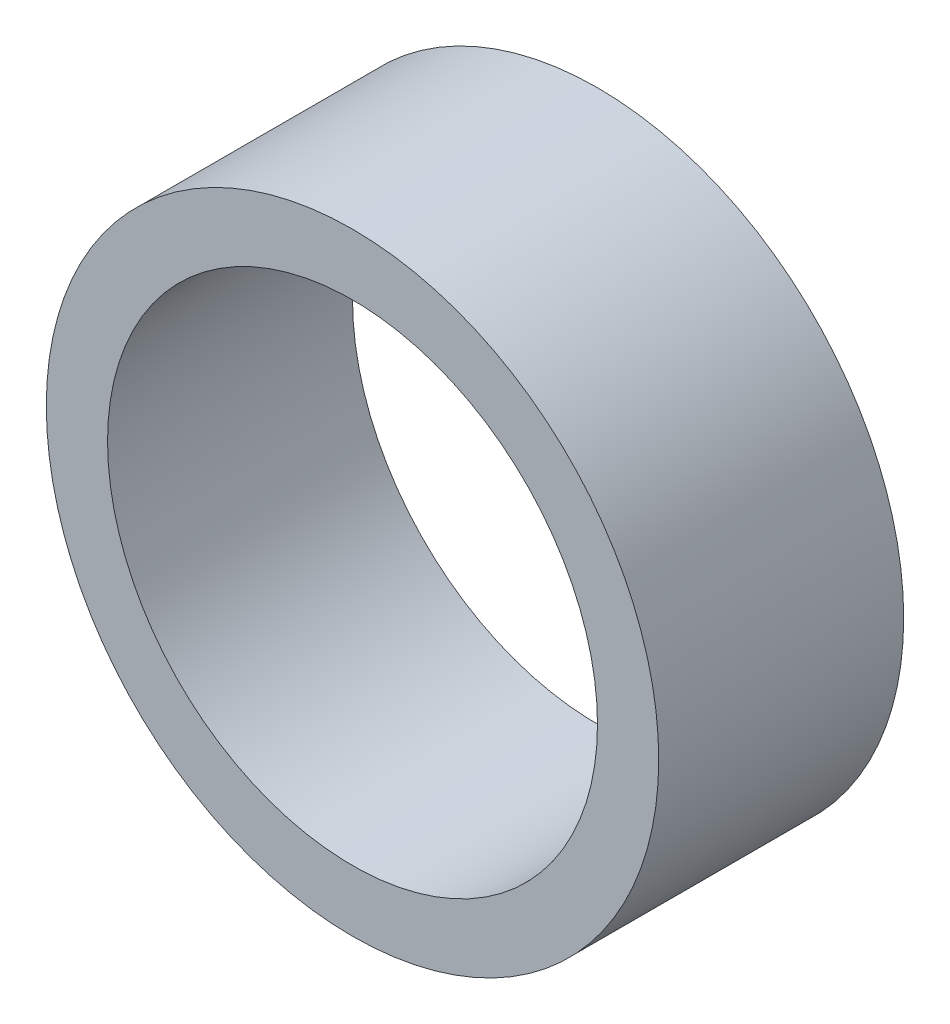
from build123d import *

# Parameters (mm, degrees)
SKETCH1_R           = 7.9375
SKETCH1_R_2         = 6.35
BOSS_EXTRUDE1_DEPTH = 6.35


with BuildPart() as part:
    # Sketch1 → Boss-Extrude1 (new body)
    with BuildSketch(Plane.XY):
        Circle(SKETCH1_R)
        Circle(SKETCH1_R_2, mode=Mode.SUBTRACT)
    extrude(amount=BOSS_EXTRUDE1_DEPTH)


solid = part.part
